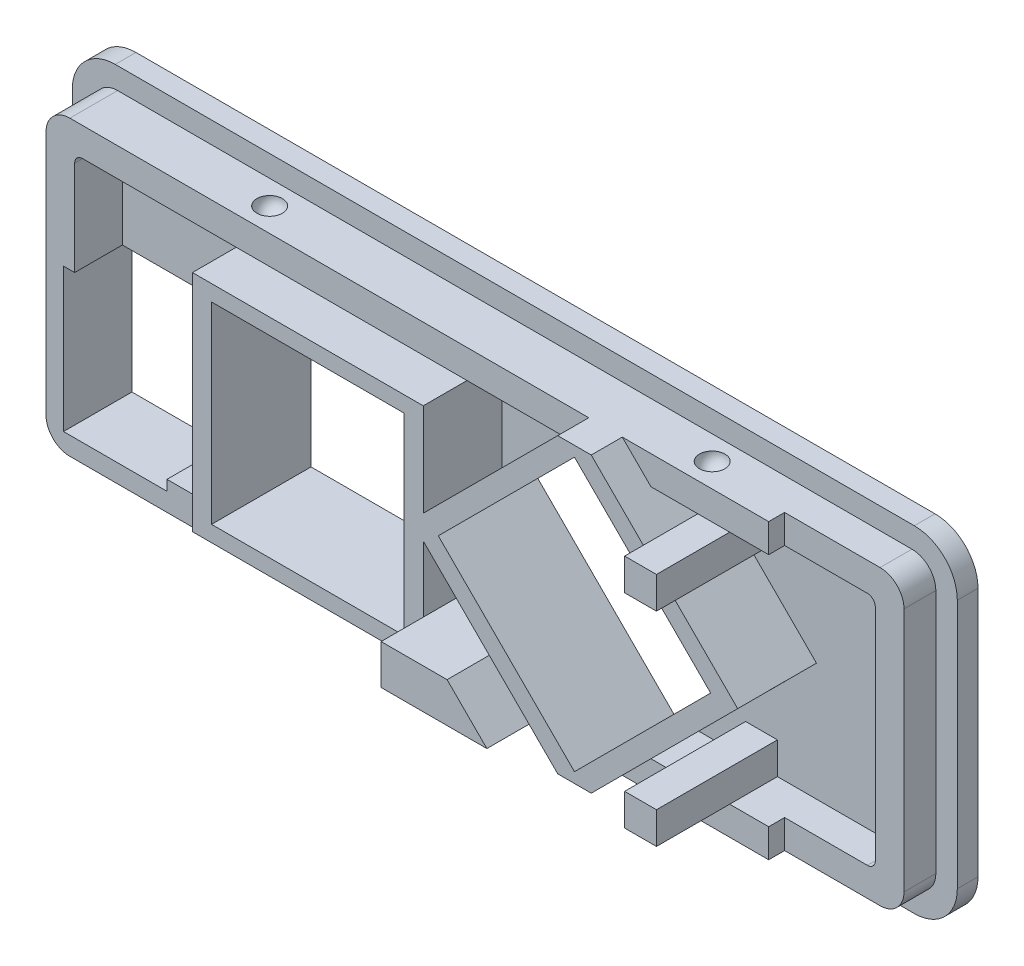
from build123d import *

# Parameters (mm, degrees)
BOSS_EXTRUDE1_DEPTH = 1.3
BOSS_EXTRUDE3_DEPTH = 3
CUT_EXTRUDE1_DEPTH  = 3
SKETCH11_W          = 6.5
SKETCH11_H          = 9
CUT_EXTRUDE2_DEPTH  = 4.3
SKETCH12_W          = 12.1
SKETCH12_H          = 12.1
CUT_EXTRUDE4_DEPTH  = 1.3
SKETCH17_W          = 14.5
SKETCH17_H          = 14.1
SKETCH17_W_2        = 12.1
SKETCH17_H_2        = 12.1
BOSS_EXTRUDE4_DEPTH = 6.25
CUT_EXTRUDE5_DEPTH  = 4.3
BOSS_EXTRUDE5_DEPTH = 6.25
CUT_EXTRUDE6_START  = -3
CUT_EXTRUDE6_DEPTH  = 23
SKETCH21_W          = 2.5
SKETCH21_H          = 2.5
CUT_EXTRUDE7_DEPTH  = 10
BOSS_EXTRUDE7_DEPTH = 7.6
SKETCH25_W          = 2
SKETCH25_H          = 2
BOSS_EXTRUDE8_DEPTH = 7.6
SKETCH27_W          = 1
SKETCH27_H          = 18.4
CUT_EXTRUDE8_DEPTH  = 7.5


with BuildPart() as part:
    # Sketch1 → Boss-Extrude1 (new body)
    with BuildSketch(Plane.XY):
        with BuildLine():
            Line((2.7, 0), (52.9, 0))
            ThreePointArc((52.9, 0), (54.809188309, 0.790811691), (55.6, 2.7))
            Line((55.6, 2.7), (55.6, 18.4))
            ThreePointArc((55.6, 18.4), (54.809188309, 20.309188309), (52.9, 21.1))
            Line((52.9, 21.1), (2.7, 21.1))
            ThreePointArc((2.7, 21.1), (0.790811691, 20.309188309), (0, 18.4))
            Line((0, 18.4), (0, 2.7))
            ThreePointArc((0, 2.7), (0.790811691, 0.790811691), (2.7, 0))
        make_face()
    extrude(amount=BOSS_EXTRUDE1_DEPTH)

    # Sketch4 → Boss-Extrude3 (add)
    with BuildSketch(Plane.XY.offset(1.3)):
        with BuildLine():
            Line((54.25, 2.85), (54.25, 18.25))
            ThreePointArc((54.25, 18.25), (53.810660172, 19.310660172), (52.75, 19.75))
            Line((52.75, 19.75), (2.85, 19.75))
            ThreePointArc((2.85, 19.75), (1.789339828, 19.310660172), (1.35, 18.25))
            Line((1.35, 18.25), (1.35, 2.85))
            ThreePointArc((1.35, 2.85), (1.789339828, 1.789339828), (2.85, 1.35))
            Line((2.85, 1.35), (52.75, 1.35))
            ThreePointArc((52.75, 1.35), (53.810660172, 1.789339828), (54.25, 2.85))
        make_face()
    extrude(amount=BOSS_EXTRUDE3_DEPTH)

    # Sketch5 → Cut-Extrude1 (cut)
    with BuildSketch(Plane.XY.offset(4.3)):
        with BuildLine():
            Line((51.95, 17.95), (3.65, 17.95))
            ThreePointArc((3.65, 17.95), (3.296446609, 17.803553391), (3.15, 17.45))
            Line((3.15, 17.45), (3.15, 3.65))
            ThreePointArc((3.15, 3.65), (3.296446609, 3.296446609), (3.65, 3.15))
            Line((3.65, 3.15), (51.95, 3.15))
            ThreePointArc((51.95, 3.15), (52.303553391, 3.296446609), (52.45, 3.65))
            Line((52.45, 3.65), (52.45, 17.45))
            ThreePointArc((52.45, 17.45), (52.303553391, 17.803553391), (51.95, 17.95))
        make_face()
    extrude(amount=-CUT_EXTRUDE1_DEPTH, mode=Mode.SUBTRACT)

    # Sketch10 → Cut-Revolve1 (revolve, cut)
    with BuildSketch(Plane(origin=(0, 19.75, 0), x_dir=(1, 0, 0), z_dir=(0, 1, 0))):
        with BuildLine():
            Line((41.7, -2), (41.7, -3.6))
            ThreePointArc((41.7, -3.6), (40.9, -2.8), (41.7, -2))
        make_face()
    cut_revolve1 = revolve(axis=Axis((41.7, 19.75, 2), (0, 0, 1)), mode=Mode.SUBTRACT)

    # Mirror1: Cut-Revolve1 across plane
    add(cut_revolve1.mirror(Plane(origin=(0, 10.55, 0), x_dir=(0, 0, 1), z_dir=(0, -1, 0))), mode=Mode.SUBTRACT)

    # Sketch11 → Cut-Extrude2 (cut)
    with BuildSketch(Plane(origin=(0, 0, 0), x_dir=(-1, 0, 0), z_dir=(0, 0, -1))):
        with Locations((-5.7, 7)):
            Rectangle(SKETCH11_W, SKETCH11_H)
    extrude(amount=-CUT_EXTRUDE2_DEPTH, mode=Mode.SUBTRACT)

    # Sketch12 → Cut-Extrude4 (cut)
    with BuildSketch(Plane(origin=(0, 0, 0), x_dir=(-1, 0, 0), z_dir=(0, 0, -1))):
        with Locations((-19.75, 10.1)):
            Rectangle(SKETCH12_W, SKETCH12_H)
    extrude(amount=-CUT_EXTRUDE4_DEPTH, mode=Mode.SUBTRACT)

    # Sketch17 → Boss-Extrude4 (add)
    with BuildSketch(Plane(origin=(0, 0, 0), x_dir=(-1, 0, 0), z_dir=(0, 0, -1))):
        with Locations((-19.75, 10.1)):
            Rectangle(SKETCH17_W, SKETCH17_H)
        with Locations((-19.75, 10.1)):
            Rectangle(SKETCH17_W_2, SKETCH17_H_2, mode=Mode.SUBTRACT)
    extrude(amount=-BOSS_EXTRUDE4_DEPTH)

    # Sketch13 → Cut-Extrude5 (cut)
    with BuildSketch(Plane(origin=(0, 0, 0), x_dir=(-1, 0, 0), z_dir=(0, 0, -1))):
        Polygon((-45.055992052, 10.55), (-36.5, 1.994007948), (-27.944007948, 10.55), (-36.5, 19.105992052), align=None)
    extrude(amount=-CUT_EXTRUDE5_DEPTH, mode=Mode.SUBTRACT)

    # Sketch18 → Boss-Extrude5 (add)
    with BuildSketch(Plane(origin=(0, 0, 0), x_dir=(-1, 0, 0), z_dir=(0, 0, -1))):
        Polygon((-46.753048327, 10.55), (-36.5, 0.296951673), (-26.246951673, 10.55), (-36.5, 20.803048327), align=None)
        Polygon((-36.5, 19.105992052), (-45.055992052, 10.55), (-36.5, 1.994007948), (-27.944007948, 10.55), align=None, mode=Mode.SUBTRACT)
    extrude(amount=-BOSS_EXTRUDE5_DEPTH)

    # Sketch20 → Cut-Extrude6 (cut)
    with BuildSketch(Plane.XY.offset(4.3).offset(CUT_EXTRUDE6_START)):
        Polygon((35.446951673, 19.75), (37.553048327, 19.75), (36.5, 20.803048327), align=None)
    cut_extrude6 = extrude(amount=CUT_EXTRUDE6_DEPTH, mode=Mode.SUBTRACT)

    # Mirror2: Cut-Extrude6 across plane
    add(cut_extrude6.mirror(Plane(origin=(0, 10.55, 0), x_dir=(0, 0, 1), z_dir=(0, -1, 0))), mode=Mode.SUBTRACT)

    # Sketch21 → Cut-Extrude7 (cut)
    with BuildSketch(Plane(origin=(0, 0, 0), x_dir=(-1, 0, 0), z_dir=(0, 0, -1))):
        with Locations((-29, 16.6)):
            Rectangle(SKETCH21_W, SKETCH21_H)
    extrude(amount=-CUT_EXTRUDE7_DEPTH, mode=Mode.SUBTRACT)

    # Mirror3: Cut-Revolve1 across plane
    add(cut_revolve1.mirror(Plane.ZY.offset(-27.8)), mode=Mode.SUBTRACT)

    # Mirror3 copy 1 sketch → Mirror3 copy 1 (revolve, cut)
    with BuildSketch(Plane(origin=(55.6, 1.35, 0), x_dir=(-1, 0, 0), z_dir=(0, -1, 0))):
        with BuildLine():
            Line((41.7, -2), (41.7, -3.6))
            ThreePointArc((41.7, -3.6), (40.9, -2.8), (41.7, -2))
        make_face()
    revolve(axis=Axis((13.9, 1.35, 2), (0, 0, 1)), mode=Mode.SUBTRACT)

    # Sketch24 → Boss-Extrude7 (add)
    with BuildSketch(Plane.XY.offset(1.3)):
        Polygon((33.646951673, 3.15), (27, 3.15), (27, 5.65), (31.146951673, 5.65), align=None)
    extrude(amount=BOSS_EXTRUDE7_DEPTH)

    # Sketch25 → Boss-Extrude8 (add)
    with BuildSketch(Plane.XY.offset(1.3)):
        with Locations((43.3, 4.15)):
            Rectangle(SKETCH25_W, SKETCH25_H)
    boss_extrude8 = extrude(amount=BOSS_EXTRUDE8_DEPTH)

    # Mirror4: Boss-Extrude8 across plane
    add(boss_extrude8.mirror(Plane(origin=(0, 10.55, 0), x_dir=(0, 0, 1), z_dir=(0, -1, 0))))

    # Sketch27 → Cut-Extrude8 (cut)
    with BuildSketch(Plane(origin=(54.25, 0, 0), x_dir=(0, 0, -1), z_dir=(1, 0, 0))):
        with Locations((-3.8, 10.55)):
            Rectangle(SKETCH27_W, SKETCH27_H)
    extrude(amount=-CUT_EXTRUDE8_DEPTH, mode=Mode.SUBTRACT)


solid = part.part
